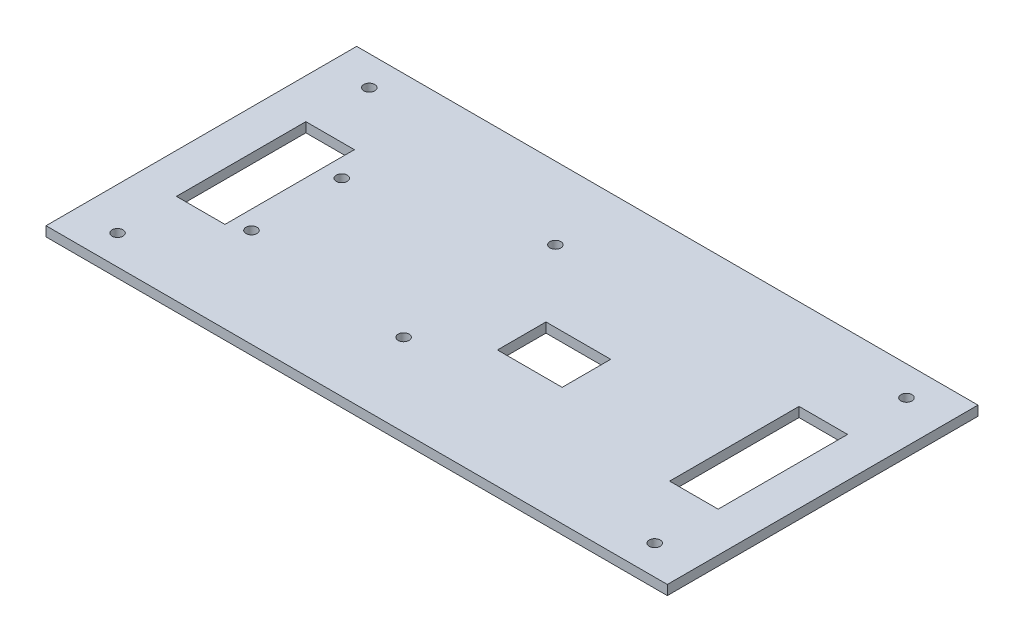
from build123d import *

# Parameters (mm, degrees)
SKETCH1_W            = 192
SKETCH1_H            = 96
BOSS_EXTRUDE1_DEPTH  = 3
M3_CLEARANCE_HOLE1_D = 3.4
SKETCH6_W            = 15
SKETCH6_H            = 40
SKETCH6_W_2          = 20
SKETCH6_H_2          = 15
CUT_EXTRUDE1_DEPTH   = 215.683487954
M3_CLEARANCE_HOLE2_D = 3.4


with BuildPart() as part:
    # Sketch1 → Boss-Extrude1 (new body)
    with BuildSketch(Plane(origin=(0, 0, 0), x_dir=(1, 0, 0), z_dir=(0, 1, 0))):
        with Locations((96, 48)):
            Rectangle(SKETCH1_W, SKETCH1_H)
    extrude(amount=BOSS_EXTRUDE1_DEPTH)

    # M3 Clearance Hole1 (through all)
    with Locations(Plane(origin=(0, 0, 0), x_dir=(-1, 0, 0), z_dir=(0, -1, 0))):
        with Locations((-13, 9.1), (-179, 9.1), (-179, 86.9), (-13, 86.9)):
            Hole(M3_CLEARANCE_HOLE1_D / 2)

    # Sketch6 → Cut-Extrude1 (cut, through all)
    with BuildSketch(Plane.XZ):
        with Locations((19.8, -48)):
            Rectangle(SKETCH6_W, SKETCH6_H)
        with Locations((172.2, -48)):
            Rectangle(SKETCH6_W, SKETCH6_H)
        with Locations((113, -44)):
            Rectangle(SKETCH6_W_2, SKETCH6_H_2)
    extrude(amount=-CUT_EXTRUDE1_DEPTH, mode=Mode.SUBTRACT)

    # M3 Clearance Hole2 (through all)
    with Locations(Plane(origin=(0, 0, 0), x_dir=(-1, 0, 0), z_dir=(0, -1, 0))):
        with Locations((-33, 58.4), (-33, 30.5), (-85.11, 25.4), (-83.8, 73.6)):
            Hole(M3_CLEARANCE_HOLE2_D / 2)


solid = part.part
